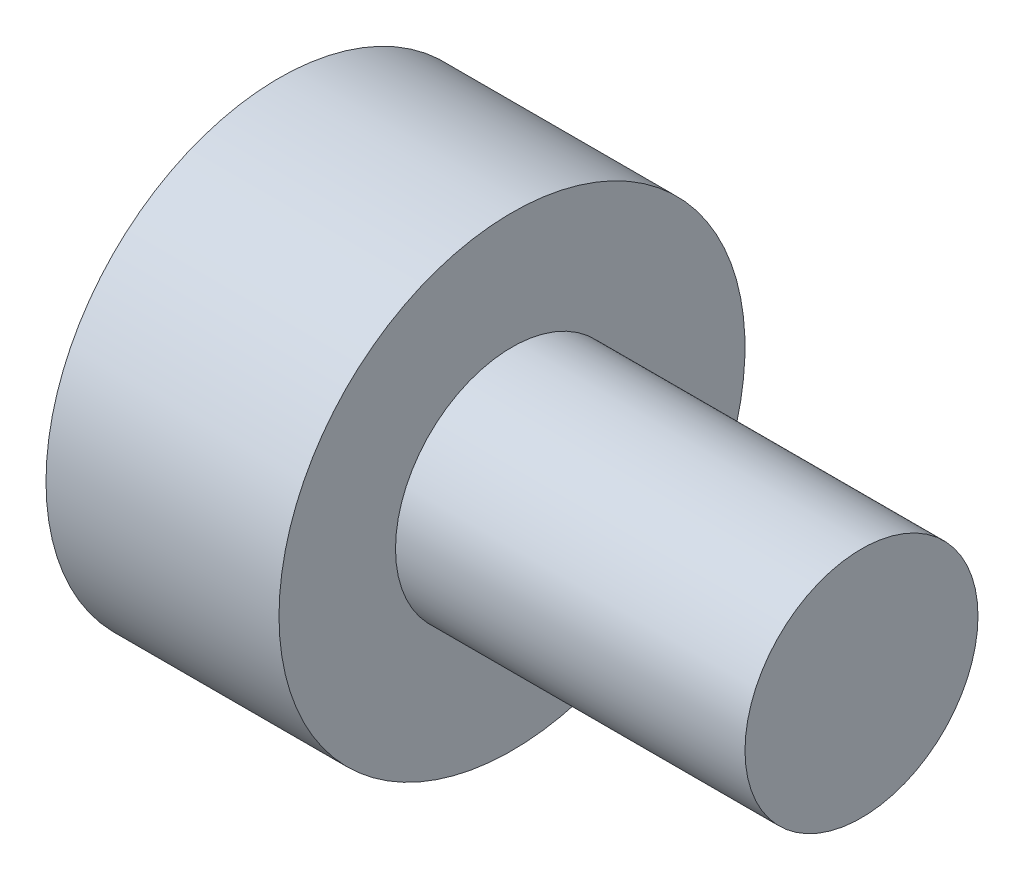
from build123d import *


with BuildPart() as part:
    # Esquisse1 → Révolution1 (revolve)
    with BuildSketch(Plane.XY, mode=Mode.PRIVATE) as r_volution1_sk:
        Polygon((50, 10), (20, 10), (20, 20), (0, 20), (0, 0), (50, 0), align=None)
    revolve(r_volution1_sk.sketch.rotate(Axis((0, 0, 0), (1, 0, 0)), 90), axis=Axis((0, 0, 0), (1, 0, 0)))


solid = part.part
